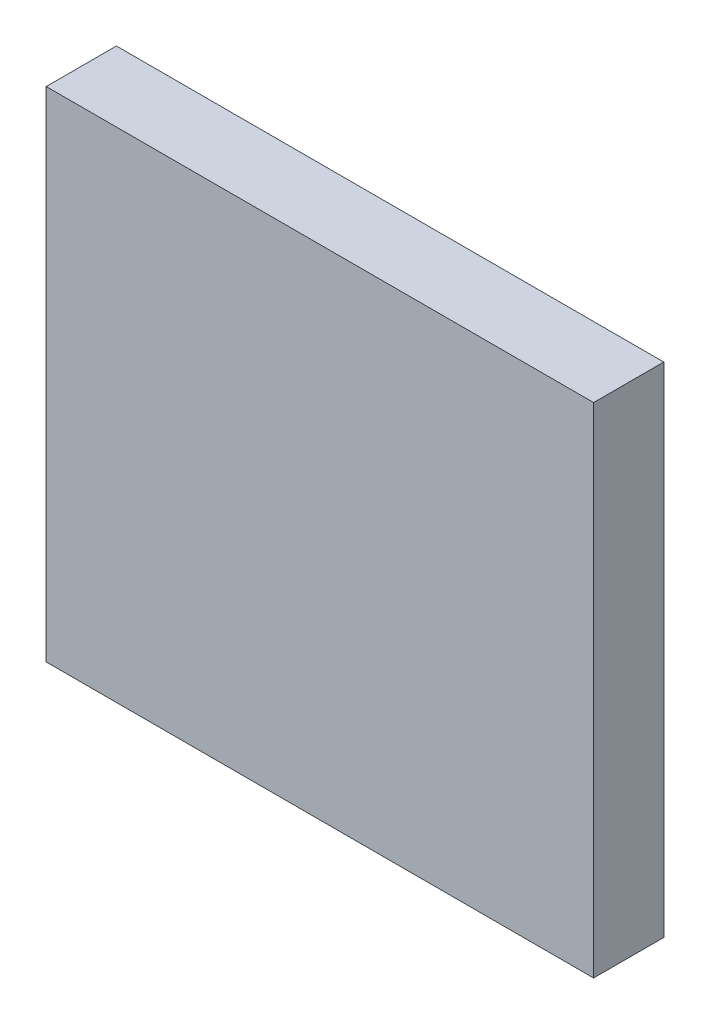
from build123d import *

# Parameters (mm, degrees)
SKETCH1_W               = 7.8
SKETCH1_H               = 7.1016
COMPONENT_OUTLINE_DEPTH = 1


with BuildPart() as part:
    # Sketch1 → Component_Outline (new body)
    with BuildSketch(Plane.XY):
        with Locations((1.75, -0.0492)):
            Rectangle(SKETCH1_W, SKETCH1_H)
    extrude(amount=COMPONENT_OUTLINE_DEPTH)


solid = part.part
